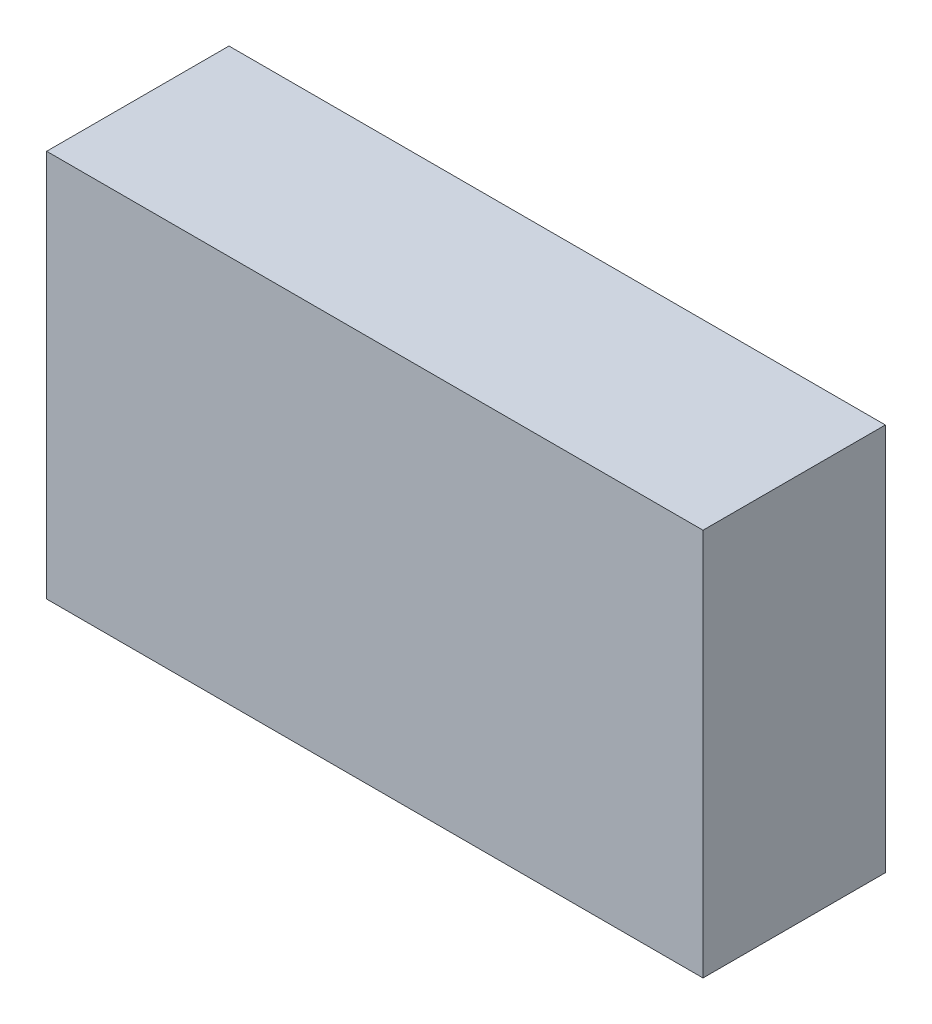
from build123d import *

# Parameters (mm, degrees)
SKETCH1_W               = 3.6
SKETCH1_H               = 2.127
COMPONENT_OUTLINE_DEPTH = 1


with BuildPart() as part:
    # Sketch1 → Component_Outline (new body)
    with BuildSketch(Plane.XY):
        Rectangle(SKETCH1_W, SKETCH1_H)
    extrude(amount=COMPONENT_OUTLINE_DEPTH)


solid = part.part
